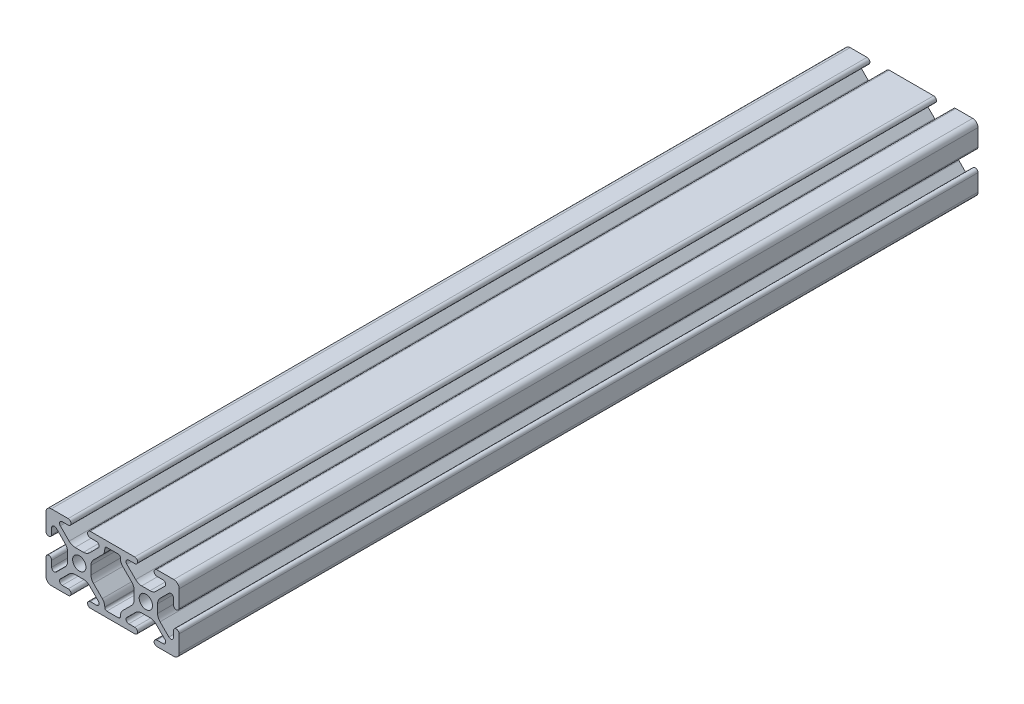
from build123d import *

# Parameters (mm, degrees)
SKETCH1_R      = 2.5
EXTRUDE1_DEPTH = 300


with BuildPart() as part:
    # Sketch1 → Extrude1 (new body)
    with BuildSketch(Plane.XY):
        with BuildLine():
            ThreePointArc((-10.5, 12.5), (-11.914213562, 11.914213562), (-12.5, 10.5))
            Line((-12.5, 10.5), (-12.5, 4.173306336))
            ThreePointArc((-12.5, 4.173306336), (-11.43, 3.103306336), (-10.36, 4.173306336))
            Line((-10.36, 4.173306336), (-10.36, 6.428177131))
            ThreePointArc((-10.36, 6.428177131), (-9.741558145, 7.353740775), (-8.649781387, 7.136572875))
            Line((-8.649781387, 7.136572875), (-5.328471504, 3.815262992))
            ThreePointArc((-5.328471504, 3.815262992), (-4.641301882, 2.786840976), (-4.4, 1.573734496))
            Line((-4.4, 1.573734496), (-4.4, -1.573734496))
            ThreePointArc((-4.4, -1.573734496), (-4.641301882, -2.786840976), (-5.328471504, -3.815262992))
            Line((-5.328471504, -3.815262992), (-8.649781387, -7.136572875))
            ThreePointArc((-8.649781387, -7.136572875), (-9.741558145, -7.353740775), (-10.36, -6.428177131))
            Line((-10.36, -6.428177131), (-10.36, -4.173306336))
            ThreePointArc((-10.36, -4.173306336), (-11.43, -3.103306336), (-12.5, -4.173306336))
            Line((-12.5, -4.173306336), (-12.5, -10.5))
            ThreePointArc((-12.5, -10.5), (-11.914213562, -11.914213562), (-10.5, -12.5))
            Line((-10.5, -12.5), (-4.173306336, -12.5))
            ThreePointArc((-4.173306336, -12.5), (-3.103306336, -11.43), (-4.173306336, -10.36))
            Line((-4.173306336, -10.36), (-6.428177131, -10.36))
            ThreePointArc((-6.428177131, -10.36), (-7.353740775, -9.741558145), (-7.136572875, -8.649781387))
            Line((-7.136572875, -8.649781387), (-3.815262992, -5.328471504))
            ThreePointArc((-3.815262992, -5.328471504), (-2.786840976, -4.641301882), (-1.573734496, -4.4))
            Line((-1.573734496, -4.4), (1.573734496, -4.4))
            ThreePointArc((1.573734496, -4.4), (2.786840976, -4.641301882), (3.815262992, -5.328471504))
            Line((3.815262992, -5.328471504), (7.136572875, -8.649781387))
            ThreePointArc((7.136572875, -8.649781387), (7.353740775, -9.741558145), (6.428177131, -10.36))
            Line((6.428177131, -10.36), (4.173306336, -10.36))
            ThreePointArc((4.173306336, -10.36), (3.103306336, -11.43), (4.173306336, -12.5))
            Line((4.173306336, -12.5), (20.826693664, -12.5))
            ThreePointArc((20.826693664, -12.5), (21.896693664, -11.43), (20.826693664, -10.36))
            Line((20.826693664, -10.36), (18.571822869, -10.36))
            ThreePointArc((18.571822869, -10.36), (17.646259225, -9.741558145), (17.863427125, -8.649781387))
            Line((17.863427125, -8.649781387), (21.184737008, -5.328471504))
            ThreePointArc((21.184737008, -5.328471504), (22.213159024, -4.641301882), (23.426265504, -4.4))
            Line((23.426265504, -4.4), (26.573734496, -4.4))
            ThreePointArc((26.573734496, -4.4), (27.786840976, -4.641301882), (28.815262992, -5.328471504))
            Line((28.815262992, -5.328471504), (32.136572875, -8.649781387))
            ThreePointArc((32.136572875, -8.649781387), (32.353740775, -9.741558145), (31.428177131, -10.36))
            Line((31.428177131, -10.36), (29.173306336, -10.36))
            ThreePointArc((29.173306336, -10.36), (28.103306336, -11.43), (29.173306336, -12.5))
            Line((29.173306336, -12.5), (35.5, -12.5))
            ThreePointArc((35.5, -12.5), (36.914213562, -11.914213562), (37.5, -10.5))
            Line((37.5, -10.5), (37.5, -4.173306336))
            ThreePointArc((37.5, -4.173306336), (36.43, -3.103306336), (35.36, -4.173306336))
            Line((35.36, -4.173306336), (35.36, -6.428177131))
            ThreePointArc((35.36, -6.428177131), (34.741558145, -7.353740775), (33.649781387, -7.136572875))
            Line((33.649781387, -7.136572875), (30.328471504, -3.815262992))
            ThreePointArc((30.328471504, -3.815262992), (29.641301882, -2.786840976), (29.4, -1.573734496))
            Line((29.4, -1.573734496), (29.4, 1.573734496))
            ThreePointArc((29.4, 1.573734496), (29.641301882, 2.786840976), (30.328471504, 3.815262992))
            Line((30.328471504, 3.815262992), (33.649781387, 7.136572875))
            ThreePointArc((33.649781387, 7.136572875), (34.741558145, 7.353740775), (35.36, 6.428177131))
            Line((35.36, 6.428177131), (35.36, 4.173306336))
            ThreePointArc((35.36, 4.173306336), (36.43, 3.103306336), (37.5, 4.173306336))
            Line((37.5, 4.173306336), (37.5, 10.5))
            ThreePointArc((37.5, 10.5), (36.914213562, 11.914213562), (35.5, 12.5))
            Line((35.5, 12.5), (29.173306336, 12.5))
            ThreePointArc((29.173306336, 12.5), (28.103306336, 11.43), (29.173306336, 10.36))
            Line((29.173306336, 10.36), (31.428177131, 10.36))
            ThreePointArc((31.428177131, 10.36), (32.353740775, 9.741558145), (32.136572875, 8.649781387))
            Line((32.136572875, 8.649781387), (28.815262992, 5.328471504))
            ThreePointArc((28.815262992, 5.328471504), (27.786840976, 4.641301882), (26.573734496, 4.4))
            Line((26.573734496, 4.4), (23.426265504, 4.4))
            ThreePointArc((23.426265504, 4.4), (22.213159024, 4.641301882), (21.184737008, 5.328471504))
            Line((21.184737008, 5.328471504), (17.863427125, 8.649781387))
            ThreePointArc((17.863427125, 8.649781387), (17.646259225, 9.741558145), (18.571822869, 10.36))
            Line((18.571822869, 10.36), (20.826693664, 10.36))
            ThreePointArc((20.826693664, 10.36), (21.896693664, 11.43), (20.826693664, 12.5))
            Line((20.826693664, 12.5), (4.173306336, 12.5))
            ThreePointArc((4.173306336, 12.5), (3.103306336, 11.43), (4.173306336, 10.36))
            Line((4.173306336, 10.36), (6.428177131, 10.36))
            ThreePointArc((6.428177131, 10.36), (7.353740775, 9.741558145), (7.136572875, 8.649781387))
            Line((7.136572875, 8.649781387), (3.815262992, 5.328471504))
            ThreePointArc((3.815262992, 5.328471504), (2.786840976, 4.641301882), (1.573734496, 4.4))
            Line((1.573734496, 4.4), (-1.573734496, 4.4))
            ThreePointArc((-1.573734496, 4.4), (-2.786840976, 4.641301882), (-3.815262992, 5.328471504))
            Line((-3.815262992, 5.328471504), (-7.136572875, 8.649781387))
            ThreePointArc((-7.136572875, 8.649781387), (-7.353740775, 9.741558145), (-6.428177131, 10.36))
            Line((-6.428177131, 10.36), (-4.173306336, 10.36))
            ThreePointArc((-4.173306336, 10.36), (-3.103306336, 11.43), (-4.173306336, 12.5))
            Line((-4.173306336, 12.5), (-10.5, 12.5))
        make_face()
        Circle(SKETCH1_R, mode=Mode.SUBTRACT)
        with BuildLine():
            Line((9.563960111, -9.552897559), (9.57, -9.358177131))
            ThreePointArc((9.57, -9.358177131), (9.330842974, -8.155853572), (8.649781387, -7.136572875))
            Line((8.649781387, -7.136572875), (5.328471504, -3.815262992))
            ThreePointArc((5.328471504, -3.815262992), (4.641301882, -2.786840976), (4.4, -1.573734496))
            Line((4.4, -1.573734496), (4.4, 1.573734496))
            ThreePointArc((4.4, 1.573734496), (4.641301882, 2.786840976), (5.328471504, 3.815262992))
            Line((5.328471504, 3.815262992), (8.649781387, 7.136572875))
            ThreePointArc((8.649781387, 7.136572875), (9.330842974, 8.155853572), (9.57, 9.358177131))
            Line((9.57, 9.358177131), (9.563229944, 9.576437453))
            ThreePointArc((9.563229944, 9.576437453), (9.777196412, 10.129004945), (10.322864597, 10.36))
            Line((10.322864597, 10.36), (14.677135403, 10.36))
            ThreePointArc((14.677135403, 10.36), (15.222803588, 10.129004945), (15.436770056, 9.576437453))
            Line((15.436770056, 9.576437453), (15.43, 9.358177131))
            ThreePointArc((15.43, 9.358177131), (15.669157026, 8.155853572), (16.350218613, 7.136572875))
            Line((16.350218613, 7.136572875), (19.671528496, 3.815262992))
            ThreePointArc((19.671528496, 3.815262992), (20.358698118, 2.786840976), (20.6, 1.573734496))
            Line((20.6, 1.573734496), (20.6, -1.573734496))
            ThreePointArc((20.6, -1.573734496), (20.358698118, -2.786840976), (19.671528496, -3.815262992))
            Line((19.671528496, -3.815262992), (16.350218613, -7.136572875))
            ThreePointArc((16.350218613, -7.136572875), (15.669157026, -8.155853572), (15.43, -9.358177131))
            Line((15.43, -9.358177131), (15.436770056, -9.576437453))
            ThreePointArc((15.436770056, -9.576437453), (15.222803588, -10.129004945), (14.677135403, -10.36))
            Line((14.677135403, -10.36), (10.322499075, -10.36))
            ThreePointArc((10.322499075, -10.36), (9.785097921, -10.137401154), (9.562499075, -9.6))
            ThreePointArc((9.562499075, -9.6), (9.562864421, -9.576437453), (9.563960111, -9.552897559))
        make_face(mode=Mode.SUBTRACT)
        with Locations((25, 0)):
            Circle(SKETCH1_R, mode=Mode.SUBTRACT)
    extrude(amount=-EXTRUDE1_DEPTH)


solid = part.part
